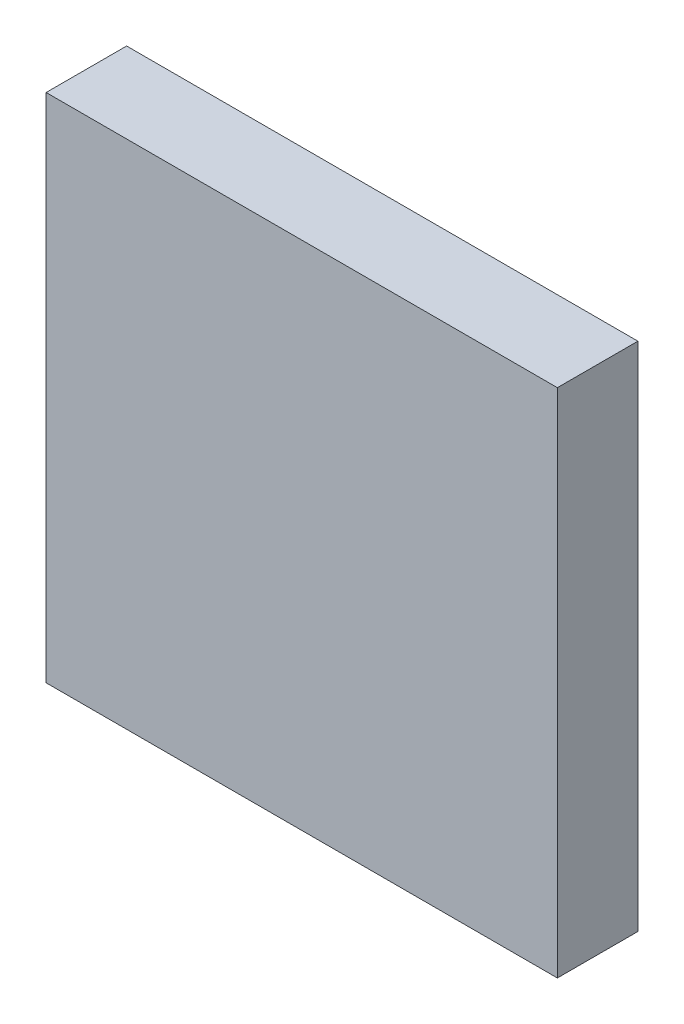
from build123d import *

# Parameters (mm, degrees)
SKETCH1_W           = 63.5
SKETCH1_H           = 63.5
BOSS_EXTRUDE1_DEPTH = 10


with BuildPart() as part:
    # Sketch1 → Boss-Extrude1 (new body)
    with BuildSketch(Plane.XY):
        Rectangle(SKETCH1_W, SKETCH1_H)
    extrude(amount=BOSS_EXTRUDE1_DEPTH)


solid = part.part
